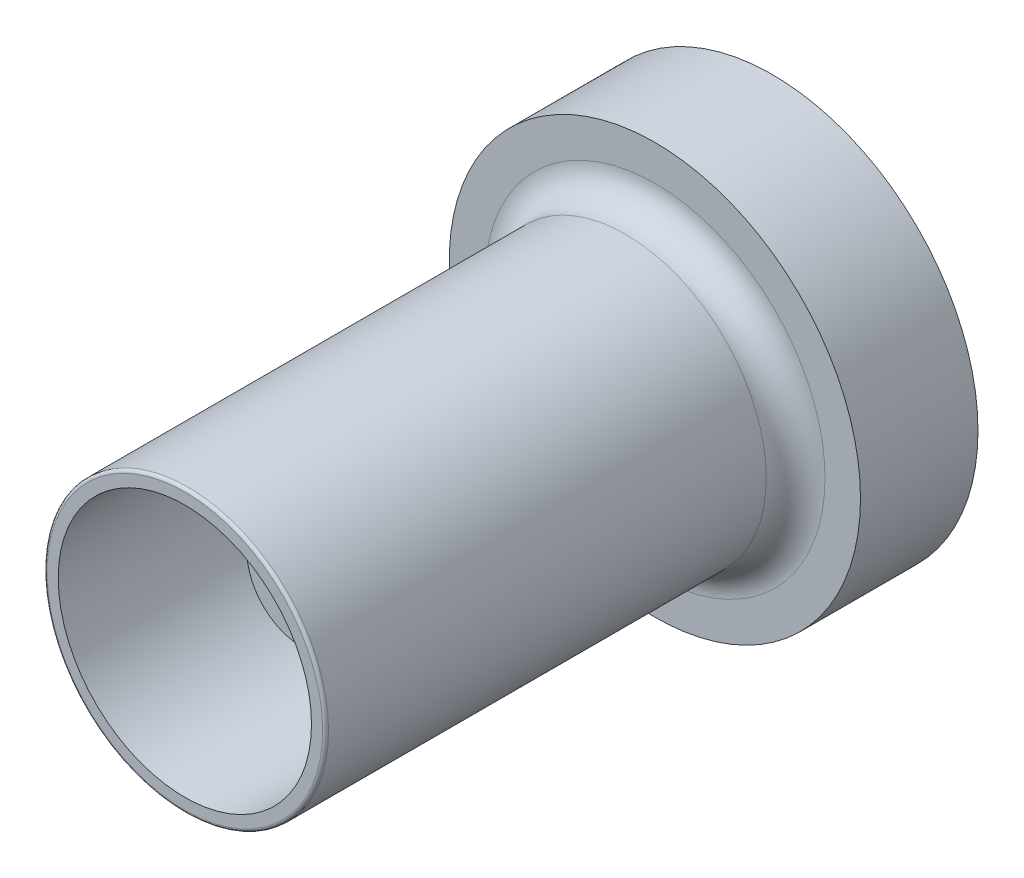
from build123d import *

# Parameters (mm, degrees)
SKETCH1_R           = 7
BOSS_EXTRUDE1_DEPTH = 4
SKETCH2_R           = 4.791287292
BOSS_EXTRUDE2_DEPTH = 16
SKETCH3_R           = 4.310359808
CUT_EXTRUDE1_DEPTH  = 16
SKETCH4_R           = 1.889075337
SKETCH4_R_2         = 1.191130081
BOSS_EXTRUDE3_DEPTH = 12
FILLET1_R           = 1
FILLET2_R           = 0.1


with BuildPart() as part:
    # Sketch1 → Boss-Extrude1 (new body)
    with BuildSketch(Plane.XY):
        Circle(SKETCH1_R)
    extrude(amount=BOSS_EXTRUDE1_DEPTH)

    # Sketch2 → Boss-Extrude2 (add)
    with BuildSketch(Plane.XY.offset(4)):
        Circle(SKETCH2_R)
    extrude(amount=BOSS_EXTRUDE2_DEPTH)

    # Sketch3 → Cut-Extrude1 (cut)
    with BuildSketch(Plane.XY.offset(20)):
        Circle(SKETCH3_R)
    extrude(amount=-CUT_EXTRUDE1_DEPTH, mode=Mode.SUBTRACT)

    # Sketch4 → Boss-Extrude3 (add)
    with BuildSketch(Plane.XY.offset(4)):
        Circle(SKETCH4_R)
        Circle(SKETCH4_R_2, mode=Mode.SUBTRACT)
    extrude(amount=BOSS_EXTRUDE3_DEPTH)

    # Fillet1
    fillet1_edges = [part.edges().sort_by_distance(p)[0] for p in [
        (-4.791287292, 0, 4),
    ]]
    fillet(fillet1_edges, radius=FILLET1_R)

    # Fillet2
    fillet2_edges = [part.edges().sort_by_distance(p)[0] for p in [
        (-4.791287292, 0, 20),
    ]]
    fillet(fillet2_edges, radius=FILLET2_R)


solid = part.part
